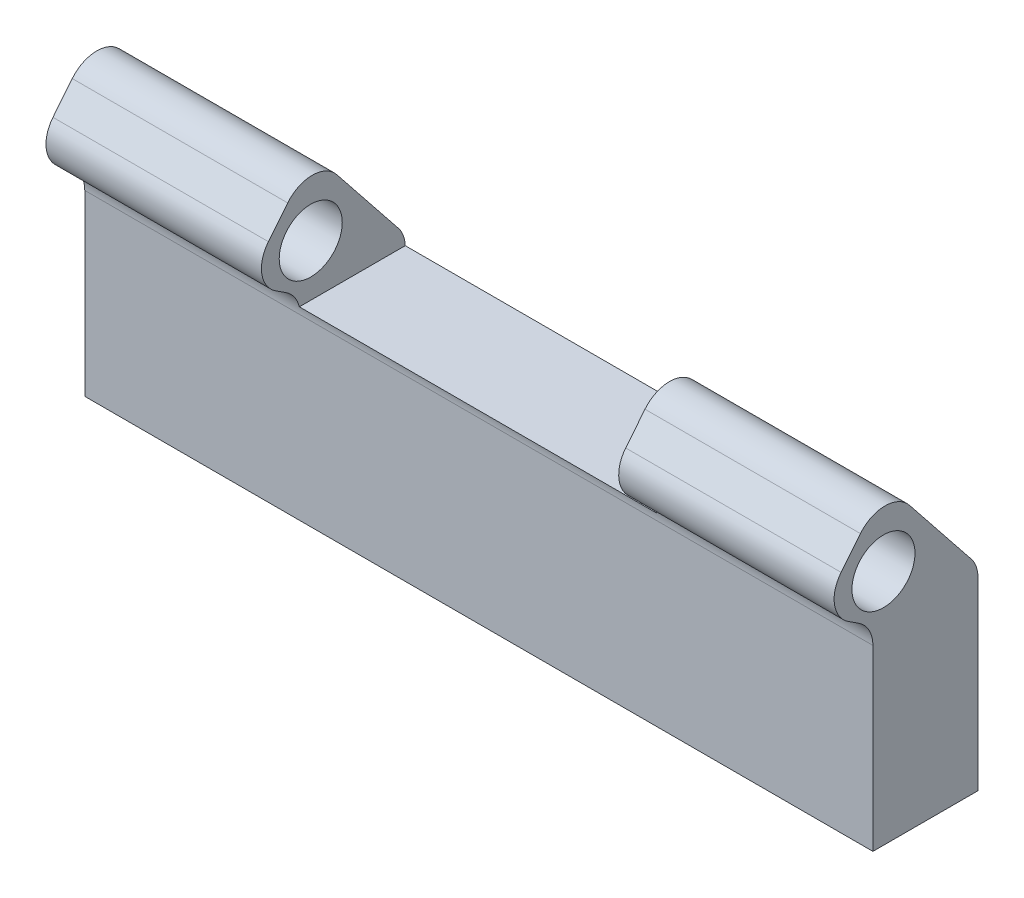
from build123d import *

# Parameters (mm, degrees)
CROQUIS1_W              = 75
CROQUIS1_H              = 10
SALIENTE_EXTRUIR1_DEPTH = 15
SALIENTE_EXTRUIR2_DEPTH = 75
CROQUIS3_W              = 34
CROQUIS3_H              = 20.463300895
CORTAR_EXTRUIR1_DEPTH   = 53
CROQUIS4_R              = 3
CORTAR_EXTRUIR2_DEPTH   = 82
CROQUIS5_R              = 3
CORTAR_EXTRUIR3_DEPTH   = 6


with BuildPart() as part:
    # Croquis1 → Saliente-Extruir1 (new body)
    with BuildSketch(Plane(origin=(0, 0, 0), x_dir=(1, 0, 0), z_dir=(0, 1, 0))):
        Rectangle(CROQUIS1_W, CROQUIS1_H)
    extrude(amount=SALIENTE_EXTRUIR1_DEPTH)

    # Croquis2 → Saliente-Extruir2 (add)
    with BuildSketch(Plane.ZY.offset(37.5)):
        with BuildLine():
            Line((-5, 15), (5, 15))
            Line((5, 15), (5, 16.974190569))
            ThreePointArc((5, 16.974190569), (5.365546157, 18.409339673), (6.373101968, 19.494746617))
            Line((6.373101968, 19.494746617), (7.318770394, 20.105130227))
            ThreePointArc((7.318770394, 20.105130227), (8.653897933, 22.149866442), (8.026350555, 24.509886785))
            Line((8.026350555, 24.509886785), (6.189450494, 26.785760885))
            ThreePointArc((6.189450494, 26.785760885), (3.846087211, 27.901547218), (1.509374249, 26.77189986))
            Line((1.509374249, 26.77189986), (-4.34559805, 19.429162497))
            ThreePointArc((-4.34559805, 19.429162497), (-4.831677431, 18.549581775), (-5, 17.558823013))
            Line((-5, 17.558823013), (-5, 15))
        make_face()
    extrude(amount=-SALIENTE_EXTRUIR2_DEPTH)

    # Croquis3 → Cortar-Extruir1 (cut)
    with BuildSketch(Plane(origin=(0, 0, -5), x_dir=(-1, 0, 0), z_dir=(0, 0, -1))):
        with Locations((0, 27.901560376)):
            Rectangle(CROQUIS3_W, CROQUIS3_H)
    extrude(amount=-CORTAR_EXTRUIR1_DEPTH, mode=Mode.SUBTRACT)

    # Croquis4 → Cortar-Extruir2 (cut)
    with BuildSketch(Plane(origin=(37.5, 0, 0), x_dir=(0, 0, -1), z_dir=(1, 0, 0))):
        with Locations((-3.996707054, 22.584588981)):
            Circle(CROQUIS4_R)
    extrude(amount=-CORTAR_EXTRUIR2_DEPTH, mode=Mode.SUBTRACT)

    # Croquis5 → Cortar-Extruir3 (cut)
    with BuildSketch(Plane.XZ):
        with Locations(Location((0, 0, 0), (0, 0, 270))):
            Circle(CROQUIS5_R)
        with Locations(Location((25, 0, 0), (0, 0, 270))):
            Circle(CROQUIS5_R)
        with Locations(Location((-25, 0, 0), (0, 0, 270))):
            Circle(CROQUIS5_R)
    extrude(amount=-CORTAR_EXTRUIR3_DEPTH, mode=Mode.SUBTRACT)


solid = part.part
